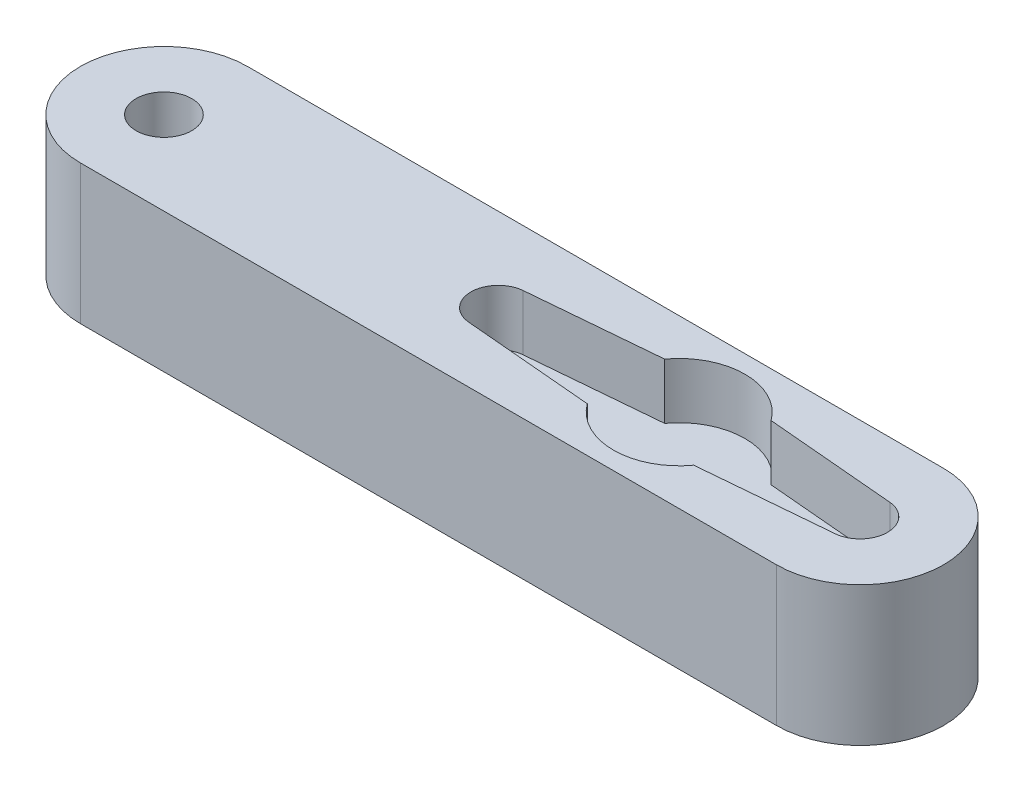
from build123d import *

# Parameters (mm, degrees)
BOSS_EXTRUDE1_DEPTH = 12.7
SKETCH4_R           = 2.54
CUT_EXTRUDE3_DEPTH  = 43.063657711
CUT_EXTRUDE6_DEPTH  = 5.08


with BuildPart() as part:
    # Sketch3 → Boss-Extrude1 (new body)
    with BuildSketch(Plane(origin=(0, 0, 0), x_dir=(1, 0, 0), z_dir=(0, 1, 0))):
        with BuildLine():
            Line((-31.75, 7.62), (31.75, 7.62))
            ThreePointArc((31.75, 7.62), (39.37, 0), (31.75, -7.62))
            Line((31.75, -7.62), (-31.75, -7.62))
            ThreePointArc((-31.75, -7.62), (-39.37, 0), (-31.75, 7.62))
        make_face()
    extrude(amount=BOSS_EXTRUDE1_DEPTH)

    # Sketch4 → Cut-Extrude3 (cut, through all)
    with BuildSketch(Plane(origin=(0, 12.7, 0), x_dir=(1, 0, 0), z_dir=(0, 1, 0))):
        with Locations(Location((-31.75, 0, 0), (0, 0, 270))):
            Circle(SKETCH4_R)
    extrude(amount=-CUT_EXTRUDE3_DEPTH, mode=Mode.SUBTRACT)

    # Sketch9 → Cut-Extrude6 (cut)
    with BuildSketch(Plane(origin=(0, 12.7, 0), x_dir=(-1, 0, 0), z_dir=(0, 1, 0))):
        with BuildLine():
            Line((1.467889357, -2.490486745), (-10.397234737, -3.528550595))
            ThreePointArc((-10.397234737, -3.528550595), (-15.25, -6), (-20.102765263, -3.528550595))
            Line((-20.102765263, -3.528550595), (-31.967889357, -2.490486745))
            ThreePointArc((-31.967889357, -2.490486745), (-34.25, 0), (-31.967889357, 2.490486745))
            Line((-31.967889357, 2.490486745), (-20.102765263, 3.528550595))
            ThreePointArc((-20.102765263, 3.528550595), (-15.25, 6), (-10.397234737, 3.528550595))
            Line((-10.397234737, 3.528550595), (1.467889357, 2.490486745))
            ThreePointArc((1.467889357, 2.490486745), (3.75, 0), (1.467889357, -2.490486745))
        make_face()
    extrude(amount=-CUT_EXTRUDE6_DEPTH, mode=Mode.SUBTRACT)


solid = part.part
